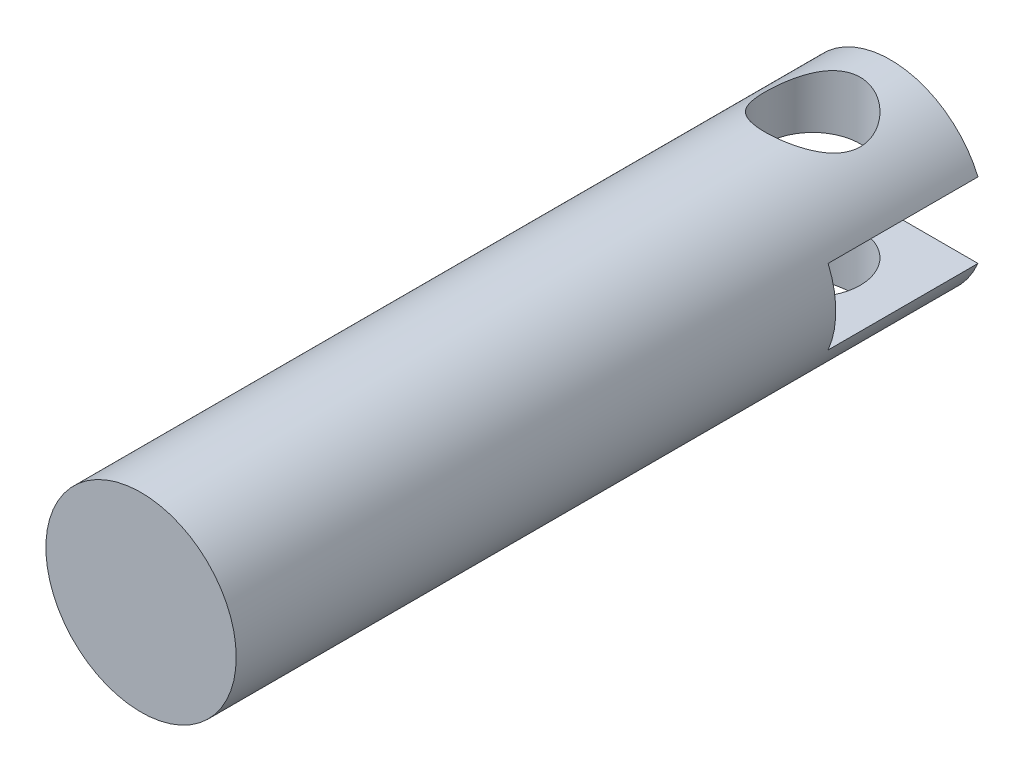
from build123d import *

# Parameters (mm, degrees)
CROQUIS1_R                 = 6.35
SALIENTE_EXTRUIR1_DEPTH    = 50
CROQUIS2_W                 = 21.76436001
CROQUIS2_H                 = 5
CORTAR_EXTRUIR1_DEPTH      = 10
CORTAR_EXTRUIR2_DEPTH      = 51.800049213
CORTAR_EXTRUIR2_DEPTH_BACK = 15.526172758
CROQUIS3_R                 = 3.175


with BuildPart() as part:
    # Croquis1 → Saliente-Extruir1 (new body)
    with BuildSketch(Plane.XY):
        Circle(CROQUIS1_R)
    extrude(amount=SALIENTE_EXTRUIR1_DEPTH)

    # Croquis2 → Cortar-Extruir1 (cut)
    with BuildSketch(Plane(origin=(0, 0, 0), x_dir=(-1, 0, 0), z_dir=(0, 0, -1))):
        Rectangle(CROQUIS2_W, CROQUIS2_H)
    extrude(amount=-CORTAR_EXTRUIR1_DEPTH, mode=Mode.SUBTRACT)

    # Croquis3 → Cortar-Extruir2 (cut, two sides: drawn at the far end of the back side and taken through both)
    with BuildSketch(Plane(origin=(0, 0, 0), x_dir=(1, 0, 0), z_dir=(0, 1, 0)).offset(-CORTAR_EXTRUIR2_DEPTH_BACK)):
        with Locations(Location((0, -5.191356095, 0), (0, 0, 270))):
            Circle(CROQUIS3_R)
    extrude(amount=CORTAR_EXTRUIR2_DEPTH + CORTAR_EXTRUIR2_DEPTH_BACK, mode=Mode.SUBTRACT)


solid = part.part
